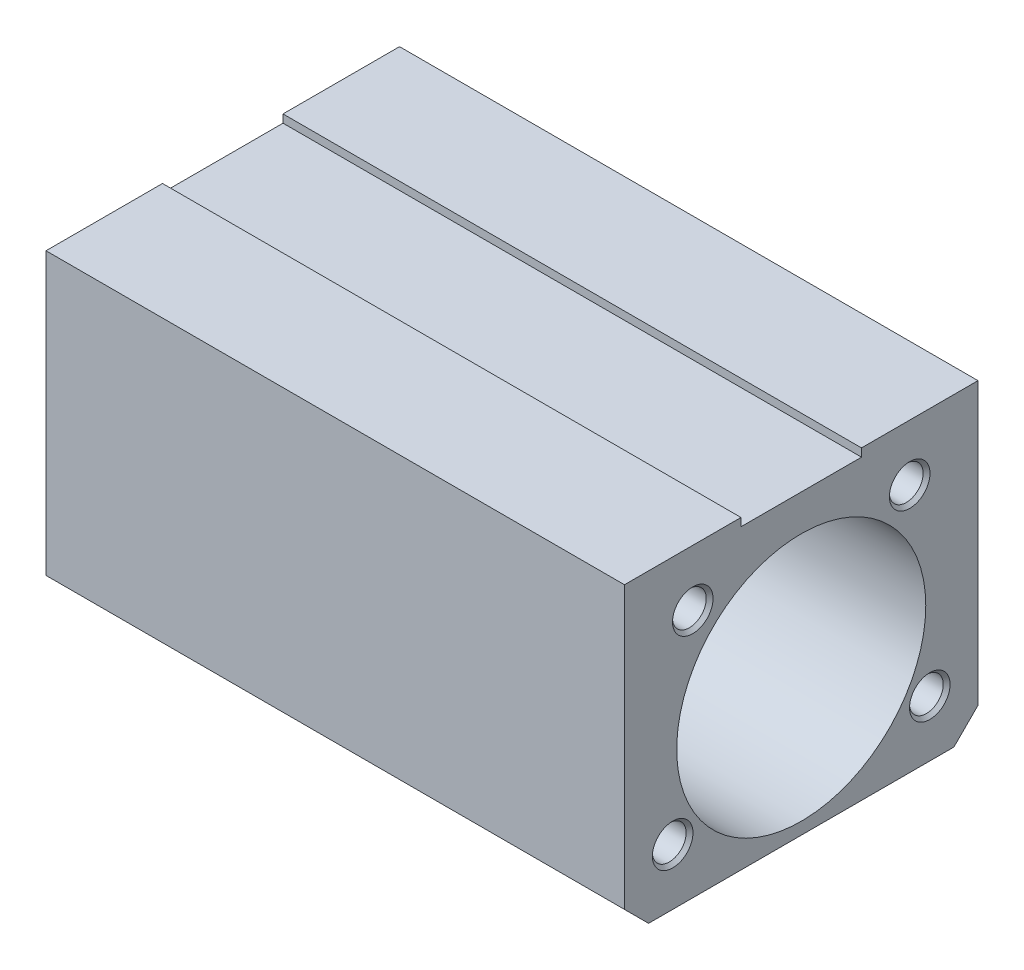
from build123d import *

# Parameters (mm, degrees)
ESBO_O1_W                       = 44
ESBO_O1_H                       = 38
RESSALTO_EXTRUS_O1_DEPTH        = 72
ESBO_O2_R                       = 15.5
CORTE_EXTRUS_O1_DEPTH           = 66
ESBO_O4_R                       = 9
CORTE_EXTRUS_O2_DEPTH           = 88.954533709
FURO_ROSCADO_DE_M51_D           = 4.2
FURO_ROSCADO_DE_M51_DEPTH       = 16.7381927
FURO_ROSCADO_DE_M51_CSINK_D     = 5.05
FURO_ROSCADO_DE_M51_CSINK_ANGLE = 90
FURO_ROSCADO_DE_M51_TIP         = 1.2618073
CHANFRO1_SIZE                   = 3
ESBO_O7_W                       = 15
ESBO_O7_H                       = 1
CORTE_EXTRUS_O3_DEPTH           = 93.54188241


with BuildPart() as part:
    # Esboço1 → Ressalto-extrusão1 (new body)
    with BuildSketch(Plane(origin=(0, 0, 0), x_dir=(0, 0, -1), z_dir=(1, 0, 0))):
        with Locations((22, 19)):
            Rectangle(ESBO_O1_W, ESBO_O1_H)
    extrude(amount=-RESSALTO_EXTRUS_O1_DEPTH)

    # Esboço2 → Corte-extrusão1 (cut)
    with BuildSketch(Plane(origin=(0, 0, 0), x_dir=(0, 0, -1), z_dir=(1, 0, 0))):
        with Locations((22, 17)):
            Circle(ESBO_O2_R)
    extrude(amount=-CORTE_EXTRUS_O1_DEPTH, mode=Mode.SUBTRACT)

    # Esboço4 → Corte-extrusão2 (cut, through all)
    with BuildSketch(Plane(origin=(-66, 0, 0), x_dir=(0, 0, -1), z_dir=(1, 0, 0))):
        with Locations((22, 17)):
            Circle(ESBO_O4_R)
    extrude(amount=-CORTE_EXTRUS_O2_DEPTH, mode=Mode.SUBTRACT)

    # Furo roscado de M51
    with Locations(Plane(origin=(0, 0, 0), x_dir=(0, 0, -1), z_dir=(1, 0, 0))):
        with Locations((8.5, 31), (35.5, 31), (38, 7), (6, 7)):
            CounterSinkHole(FURO_ROSCADO_DE_M51_D / 2, FURO_ROSCADO_DE_M51_CSINK_D / 2, depth=FURO_ROSCADO_DE_M51_DEPTH, counter_sink_angle=FURO_ROSCADO_DE_M51_CSINK_ANGLE)
            with Locations((0, 0, -(FURO_ROSCADO_DE_M51_DEPTH + FURO_ROSCADO_DE_M51_TIP / 2))):  # 118° drill point
                Cone(0, FURO_ROSCADO_DE_M51_D / 2, FURO_ROSCADO_DE_M51_TIP, mode=Mode.SUBTRACT)

    # Chanfro1
    chanfro1_edges = [part.edges().sort_by_distance(p)[0] for p in [
        (-36, 0, -44),
        (-36, 0, 0),
    ]]
    chamfer(chanfro1_edges, length=CHANFRO1_SIZE)

    # Esboço7 → Corte-extrusão3 (cut, through all)
    with BuildSketch(Plane(origin=(0, 0, 0), x_dir=(0, 0, -1), z_dir=(1, 0, 0))):
        with Locations((22, 37.5)):
            Rectangle(ESBO_O7_W, ESBO_O7_H)
    extrude(amount=-CORTE_EXTRUS_O3_DEPTH, mode=Mode.SUBTRACT)


solid = part.part
